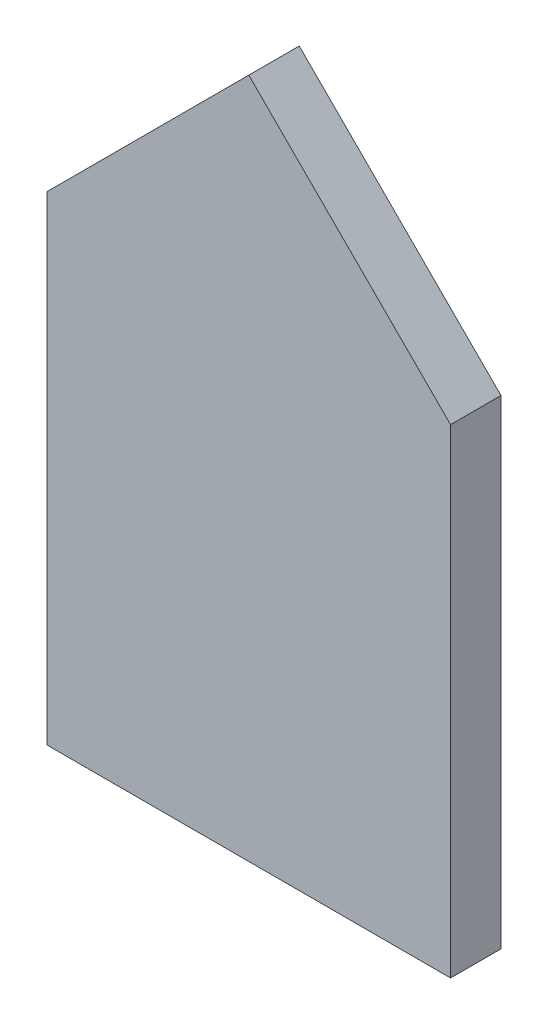
from build123d import *

# Parameters (mm, degrees)
BOSS_EXTRU_1_DEPTH = 10


with BuildPart() as part:
    # Esquisse2 → Boss.-Extru.1 (new body)
    with BuildSketch(Plane.XY):
        Polygon((-40.452353829, -55.223244796), (39.547646171, -55.223244796), (39.547646171, 39.776755204), (-0.452353829, 79.776755204), (-40.452353829, 39.776755204), align=None)
    extrude(amount=BOSS_EXTRU_1_DEPTH)


solid = part.part
